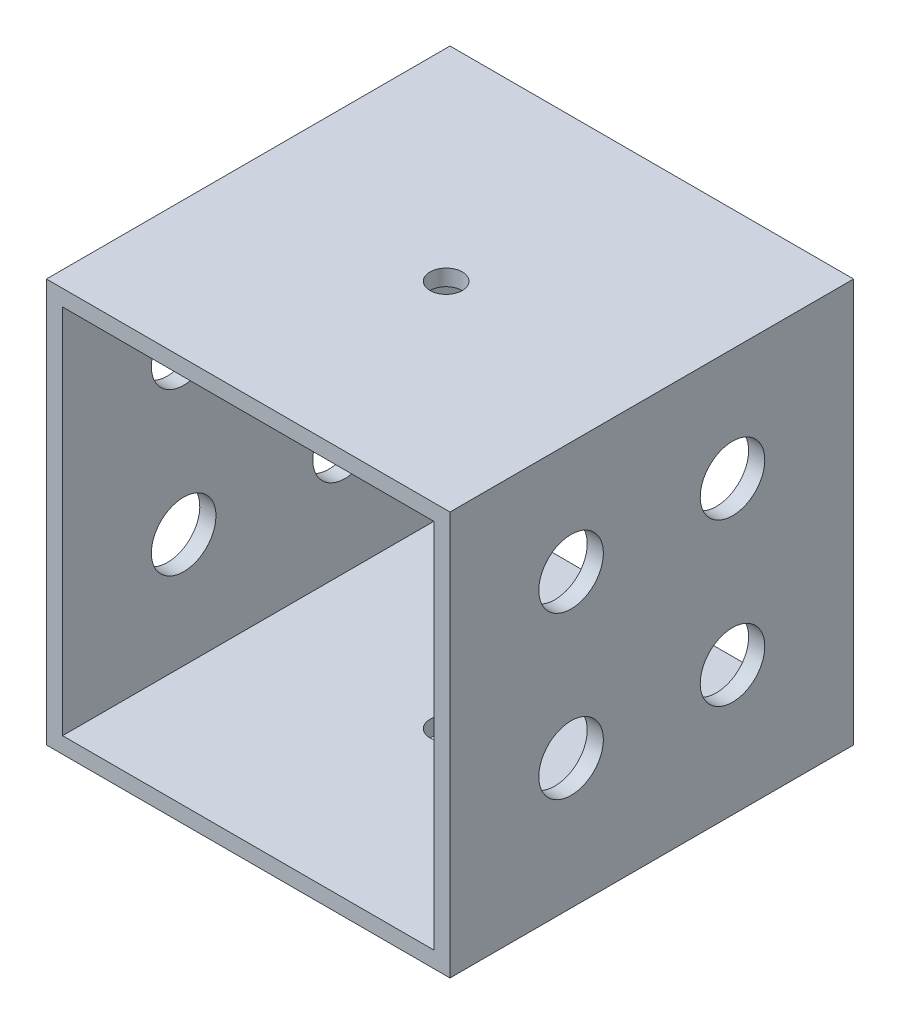
from build123d import *

# Parameters (mm, degrees)
SKETCH1_W           = 25
SKETCH1_H           = 25
SKETCH1_W_2         = 23
SKETCH1_H_2         = 23
BOSS_EXTRUDE1_DEPTH = 25
SKETCH2_R           = 1
CUT_EXTRUDE1_DEPTH  = 25
SKETCH3_R           = 2
CUT_EXTRUDE2_DEPTH  = 25


with BuildPart() as part:
    # Sketch1 → Boss-Extrude1 (new body)
    with BuildSketch(Plane.XY):
        Rectangle(SKETCH1_W, SKETCH1_H)
        Rectangle(SKETCH1_W_2, SKETCH1_H_2, mode=Mode.SUBTRACT)
    extrude(amount=BOSS_EXTRUDE1_DEPTH)

    # Sketch2 → Cut-Extrude1 (cut)
    with BuildSketch(Plane(origin=(0, 12.5, 0), x_dir=(1, 0, 0), z_dir=(0, 1, 0))):
        with Locations(Location((0, -12.738843591, 0), (0, 0, 270))):
            Circle(SKETCH2_R)
    extrude(amount=-CUT_EXTRUDE1_DEPTH, mode=Mode.SUBTRACT)

    # Sketch3 → Cut-Extrude2 (cut)
    with BuildSketch(Plane(origin=(12.5, 0, 0), x_dir=(0, 0, -1), z_dir=(1, 0, 0))):
        with Locations(Location((-17.5, 5.546478955, 0), (0, 0, 90))):
            Circle(SKETCH3_R)
        with Locations(Location((-7.5, 5.546478955, 0), (0, 0, 90))):
            Circle(SKETCH3_R)
        with Locations(Location((-17.5, -4.453521045, 0), (0, 0, 90))):
            Circle(SKETCH3_R)
        with Locations(Location((-7.5, -4.453521045, 0), (0, 0, 90))):
            Circle(SKETCH3_R)
    extrude(amount=-CUT_EXTRUDE2_DEPTH, mode=Mode.SUBTRACT)


solid = part.part
